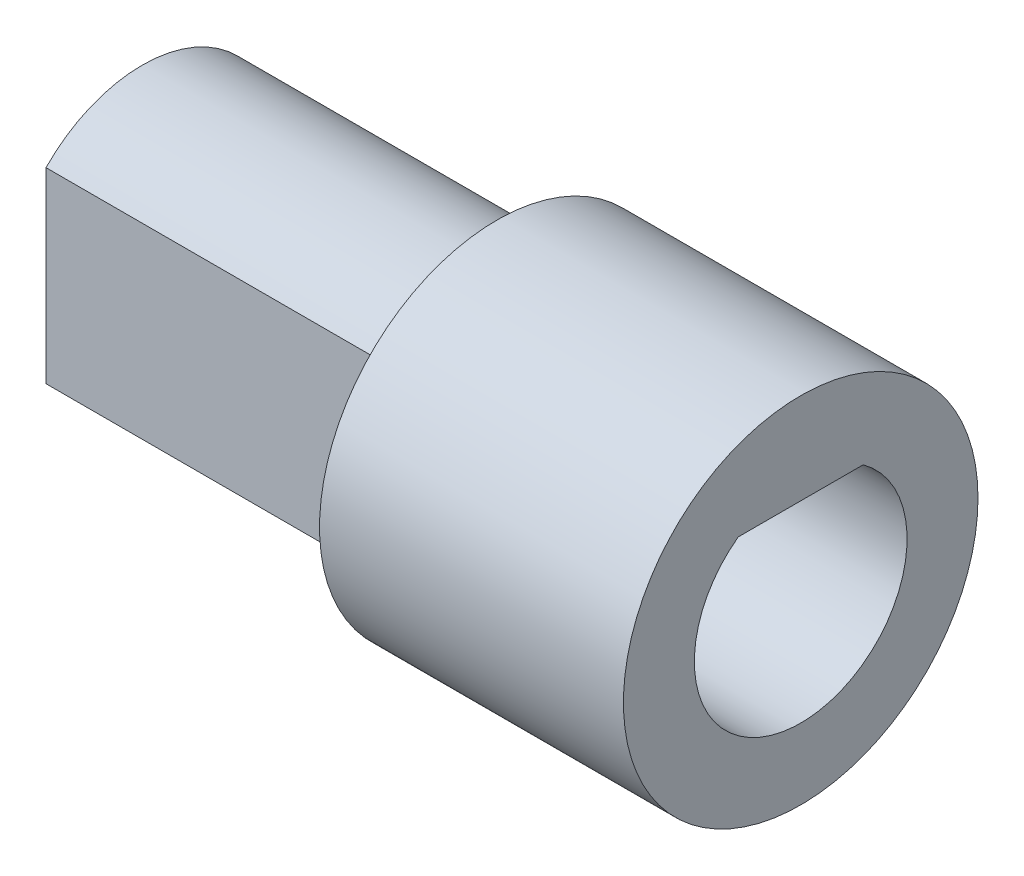
from build123d import *

# Parameters (mm, degrees)
BOSS_EXTRUDE1_DEPTH = 7
SKETCH5_R           = 3.5
BOSS_EXTRUDE2_DEPTH = 6
FILLET1_R           = 0.5
CUT_EXTRUDE1_DEPTH  = 5


with BuildPart() as part:
    # Sketch1 → Boss-Extrude1 (new body)
    with BuildSketch(Plane(origin=(0, 0, 0), x_dir=(0, 0, -1), z_dir=(1, 0, 0))):
        with BuildLine():
            Line((-1.9, 1.84729532), (-1.9, -1.84729532))
            ThreePointArc((-1.9, -1.84729532), (0, -2.65), (1.9, -1.84729532))
            Line((1.9, -1.84729532), (1.9, 1.84729532))
            ThreePointArc((1.9, 1.84729532), (0, 2.65), (-1.9, 1.84729532))
        make_face()
    extrude(amount=-BOSS_EXTRUDE1_DEPTH)

    # Sketch5 → Boss-Extrude2 (add)
    with BuildSketch(Plane(origin=(0, 0, 0), x_dir=(0, 0, -1), z_dir=(1, 0, 0))):
        Circle(SKETCH5_R)
    extrude(amount=BOSS_EXTRUDE2_DEPTH)

    # Fillet1
    fillet1_edges = [part.edges().sort_by_distance(p)[0] for p in [
        (0, 0, -1.9),
        (0, -2.65, 0),
        (0, 0, 1.9),
        (0, 2.65, 0),
    ]]
    fillet(fillet1_edges, radius=FILLET1_R)

    # Sketch7 → Cut-Extrude1 (cut)
    with BuildSketch(Plane(origin=(6, 0, 0), x_dir=(0, 0, -1), z_dir=(1, 0, 0))):
        with BuildLine():
            Line((-1.232882801, 1.7), (1.232882801, 1.7))
            ThreePointArc((1.232882801, 1.7), (0, -2.1), (-1.232882801, 1.7))
        make_face()
    extrude(amount=-CUT_EXTRUDE1_DEPTH, mode=Mode.SUBTRACT)


solid = part.part
